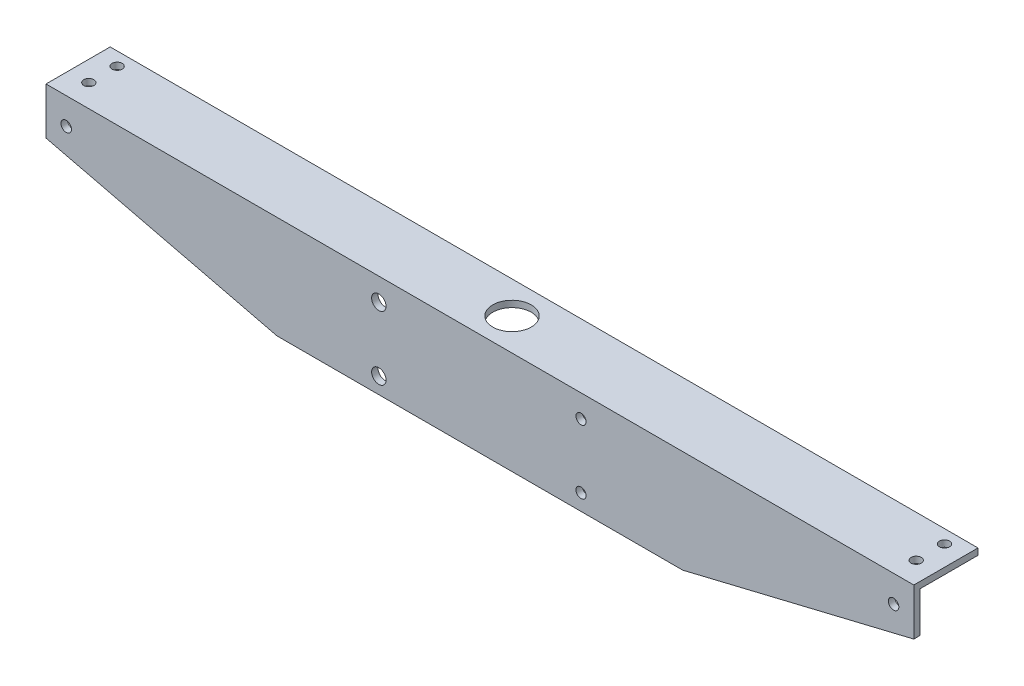
from build123d import *

# Parameters (mm, degrees)
BOSS_EXTRUDE1_DEPTH = 214.63
SKETCH2_R           = 2.5
SKETCH2_R_2         = 3.57
CUT_EXTRUDE1_DEPTH  = 223.403254304
CUT_EXTRUDE2_DEPTH  = 3.175
SKETCH4_R           = 2.5
CUT_EXTRUDE3_DEPTH  = 3.175
CUT_EXTRUDE4_REACH  = 224.131
SKETCH5_R           = 9.525
SKETCH6_R           = 2.6
CUT_EXTRUDE5_DEPTH  = 3.175


with BuildPart() as part:
    # Sketch1 → Boss-Extrude1 (new, symmetric)
    with BuildSketch(Plane(origin=(0, 0, 0), x_dir=(0, 0, -1), z_dir=(1, 0, 0))):
        Polygon((0, 0), (31.75, 0), (31.75, -3.175), (3.175, -3.175), (3.175, -50.8), (0, -50.8), align=None)
    extrude(amount=BOSS_EXTRUDE1_DEPTH, both=True)

    # Sketch2 → Cut-Extrude1 (cut, through all)
    with BuildSketch(Plane(origin=(0, 0, -3.175), x_dir=(-1, 0, 0), z_dir=(0, 0, -1))):
        with Locations(Location((-50, -11.175, 0), (0, 0, 90))):
            Circle(SKETCH2_R)
        with Locations(Location((50, -11.175, 0), (0, 0, 90))):
            Circle(SKETCH2_R_2)
        with Locations(Location((50, -42.8, 0), (0, 0, 90))):
            Circle(SKETCH2_R_2)
        with Locations(Location((-50, -42.8, 0), (0, 0, 90))):
            Circle(SKETCH2_R)
    extrude(amount=-CUT_EXTRUDE1_DEPTH, mode=Mode.SUBTRACT)

    # Sketch3 → Cut-Extrude2 (cut)
    with BuildSketch(Plane(origin=(0, 0, -3.175), x_dir=(-1, 0, 0), z_dir=(0, 0, -1))):
        Polygon((214.63, -50.8), (100.33, -50.8), (214.63, -23.175), align=None)
        Polygon((-214.63, -23.175), (-214.63, -50.8), (-100.33, -50.8), align=None)
    extrude(amount=-CUT_EXTRUDE2_DEPTH, mode=Mode.SUBTRACT)

    # Sketch4 → Cut-Extrude3 (cut)
    with BuildSketch(Plane(origin=(0, 0, 0), x_dir=(1, 0, 0), z_dir=(0, 1, 0))):
        with Locations(Location((-204.63, 11.176, 0), (0, 0, 270))):
            Circle(SKETCH4_R)
        with Locations(Location((-204.63, 25.176, 0), (0, 0, 270))):
            Circle(SKETCH4_R)
        with Locations(Location((204.63, 25.176, 0), (0, 0, 90))):
            Circle(SKETCH4_R)
        with Locations(Location((204.63, 11.176, 0), (0, 0, 90))):
            Circle(SKETCH4_R)
    extrude(amount=-CUT_EXTRUDE3_DEPTH, mode=Mode.SUBTRACT)

    # Sketch5 → Cut-Extrude4 (cut, up to next)
    with BuildSketch(Plane.XZ.offset(3.175), mode=Mode.PRIVATE) as cut_extrude4_sk1:
        with Locations(Location((0, -15.875, 0), (0, 0, 270))):
            Circle(SKETCH5_R)
    cut_extrude4_tool1 = extrude(cut_extrude4_sk1.sketch, amount=-CUT_EXTRUDE4_REACH, mode=Mode.PRIVATE) & part.part
    add(cut_extrude4_tool1.solids().sort_by_distance((0, -3.175, -15.875))[0], mode=Mode.SUBTRACT)

    # Sketch6 → Cut-Extrude5 (cut)
    with BuildSketch(Plane.XY):
        with Locations((204.63, -13.175000066)):
            Circle(SKETCH6_R)
        with Locations(Location((-204.63, -13.175000066, 0), (0, 0, 270))):
            Circle(SKETCH6_R)
    extrude(amount=-CUT_EXTRUDE5_DEPTH, mode=Mode.SUBTRACT)


solid = part.part
